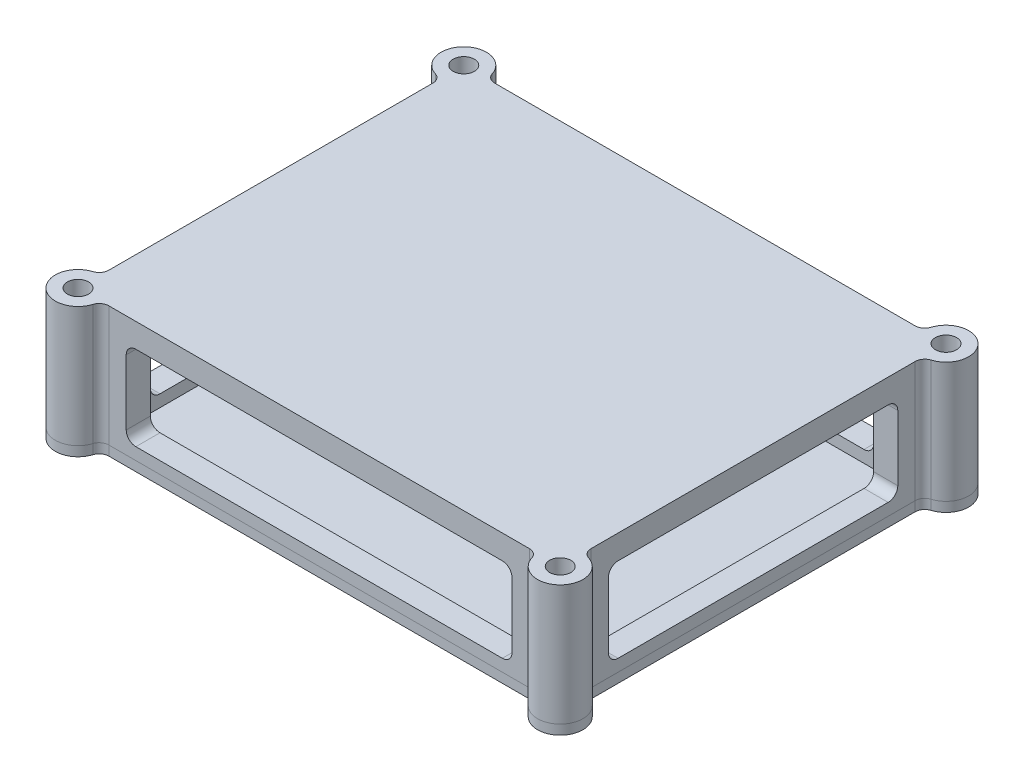
from build123d import *

# Parameters (mm, degrees)
SKETCH1_W           = 127
SKETCH1_H           = 101.6
BOSS_EXTRUDE1_DEPTH = 31.75
SKETCH3_W           = 114.3
SKETCH3_H           = 88.9
CUT_EXTRUDE1_DEPTH  = 27.94
SKETCH4_W           = 101.6
SKETCH4_H           = 22.225
CUT_EXTRUDE2_DEPTH  = 166.709452054
SKETCH5_W           = 76.2
SKETCH5_H           = 22.225
CUT_EXTRUDE3_DEPTH  = 166.709452054
SKETCH6_R           = 5.969
SKETCH6_R_2         = 2.794
BOSS_EXTRUDE2_DEPTH = 31.75
CUT_EXTRUDE4_DEPTH  = 174.953750238
FILLET1_R           = 2.54
SKETCH7_R           = 2.794
SKETCH7_W           = 76.2
SKETCH7_H           = 50.8
BOSS_EXTRUDE3_DEPTH = 2.54
FILLET2_R           = 2.54


with BuildPart() as part:
    # Sketch1 → Boss-Extrude1 (new body)
    with BuildSketch(Plane(origin=(0, 0, 0), x_dir=(1, 0, 0), z_dir=(0, 1, 0))):
        with Locations((63.5, 50.8)):
            Rectangle(SKETCH1_W, SKETCH1_H)
    extrude(amount=BOSS_EXTRUDE1_DEPTH)

    # Sketch3 → Cut-Extrude1 (cut)
    with BuildSketch(Plane.XZ):
        with Locations((63.5, -50.8)):
            Rectangle(SKETCH3_W, SKETCH3_H)
    extrude(amount=-CUT_EXTRUDE1_DEPTH, mode=Mode.SUBTRACT)

    # Sketch4 → Cut-Extrude2 (cut, through all)
    with BuildSketch(Plane(origin=(0, 0, -101.6), x_dir=(-1, 0, 0), z_dir=(0, 0, -1))):
        with Locations((-63.5, 14.2875)):
            Rectangle(SKETCH4_W, SKETCH4_H)
    extrude(amount=-CUT_EXTRUDE2_DEPTH, mode=Mode.SUBTRACT)

    # Sketch5 → Cut-Extrude3 (cut, through all)
    with BuildSketch(Plane(origin=(127, 0, 0), x_dir=(0, 0, -1), z_dir=(1, 0, 0))):
        with Locations((50.8, 14.2875)):
            Rectangle(SKETCH5_W, SKETCH5_H)
    extrude(amount=-CUT_EXTRUDE3_DEPTH, mode=Mode.SUBTRACT)

    # Sketch6 → Boss-Extrude2 (add, through all)
    # profile 1 of 6: a face of its own
    with BuildSketch(Plane(origin=(0, 0, 0), x_dir=(-1, 0, 0), z_dir=(0, -1, 0))):
        with BuildLine():
            ThreePointArc((0, 2.794), (1.975656347, 1.975656347), (2.794, 0))
            ThreePointArc((2.794, 0), (0, -2.794), (-2.794, 0))
            Line((-2.794, 0), (-5.969, 0))
            ThreePointArc((-5.969, 0), (0, -5.969), (5.969, 0))
            ThreePointArc((5.969, 0), (4.220720377, 4.220720377), (0, 5.969))
            Line((0, 5.969), (0, 2.794))
        make_face()
    # profile 2 of 6: a face of its own
    with BuildSketch(Plane(origin=(0, 0, 0), x_dir=(-1, 0, 0), z_dir=(0, -1, 0))):
        with BuildLine():
            ThreePointArc((-2.794, 0), (-1.975656347, 1.975656347), (0, 2.794))
            Line((0, 2.794), (0, 5.969))
            ThreePointArc((0, 5.969), (-4.220720377, 4.220720377), (-5.969, 0))
            Line((-5.969, 0), (-2.794, 0))
        make_face()
    # profile 3 of 6: a face of its own
    with BuildSketch(Plane(origin=(0, 0, 0), x_dir=(-1, 0, 0), z_dir=(0, -1, 0))):
        with Locations((0, 101.6)):
            Circle(SKETCH6_R)
        with Locations((0, 101.6)):
            Circle(SKETCH6_R_2, mode=Mode.SUBTRACT)
    # profile 4 of 6: a face of its own
    with BuildSketch(Plane(origin=(0, 0, 0), x_dir=(-1, 0, 0), z_dir=(0, -1, 0))):
        with Locations((-127, 101.6)):
            Circle(SKETCH6_R)
        with Locations((-127, 101.6)):
            Circle(SKETCH6_R_2, mode=Mode.SUBTRACT)
    # profile 5 of 6: a face of its own
    with BuildSketch(Plane(origin=(0, 0, 0), x_dir=(-1, 0, 0), z_dir=(0, -1, 0))):
        with BuildLine():
            ThreePointArc((-127, 5.969), (-131.220720377, -4.220720377), (-121.031, 0))
            Line((-121.031, 0), (-124.206, 0))
            ThreePointArc((-124.206, 0), (-128.975656347, -1.975656347), (-127, 2.794))
            Line((-127, 2.794), (-127, 5.969))
        make_face()
    # profile 6 of 6: a face of its own
    with BuildSketch(Plane(origin=(0, 0, 0), x_dir=(-1, 0, 0), z_dir=(0, -1, 0))):
        with BuildLine():
            Line((-124.206, 0), (-121.031, 0))
            ThreePointArc((-121.031, 0), (-122.779279623, 4.220720377), (-127, 5.969))
            Line((-127, 5.969), (-127, 2.794))
            ThreePointArc((-127, 2.794), (-125.024343653, 1.975656347), (-124.206, 0))
        make_face()
    extrude(amount=-BOSS_EXTRUDE2_DEPTH)

    # Sketch6<4> → Cut-Extrude4 (cut, through all)
    with BuildSketch(Plane(origin=(0, 0, 0), x_dir=(-1, 0, 0), z_dir=(0, -1, 0))):
        with BuildLine():
            Line((0, 101.6), (0, 98.806))
            ThreePointArc((0, 98.806), (1.975656347, 99.624343653), (2.794, 101.6))
            ThreePointArc((2.794, 101.6), (0, 104.394), (-2.794, 101.6))
            Line((-2.794, 101.6), (0, 101.6))
        make_face()
        with BuildLine():
            ThreePointArc((-2.794, 101.6), (-1.975656347, 99.624343653), (0, 98.806))
            Line((0, 98.806), (0, 101.6))
            Line((0, 101.6), (-2.794, 101.6))
        make_face()
        with BuildLine():
            Line((0, 101.6), (0, 98.806))
            ThreePointArc((0, 98.806), (1.975656347, 99.624343653), (2.794, 101.6))
            ThreePointArc((2.794, 101.6), (0, 104.394), (-2.794, 101.6))
            Line((-2.794, 101.6), (0, 101.6))
        make_face()
        with BuildLine():
            ThreePointArc((-2.794, 101.6), (-1.975656347, 99.624343653), (0, 98.806))
            Line((0, 98.806), (0, 101.6))
            Line((0, 101.6), (-2.794, 101.6))
        make_face()
        with BuildLine():
            Line((-127, 101.6), (-124.206, 101.6))
            ThreePointArc((-124.206, 101.6), (-128.975656347, 103.575656347), (-127, 98.806))
            Line((-127, 98.806), (-127, 101.6))
        make_face()
        with BuildLine():
            ThreePointArc((-127, 98.806), (-125.024343653, 99.624343653), (-124.206, 101.6))
            Line((-124.206, 101.6), (-127, 101.6))
            Line((-127, 101.6), (-127, 98.806))
        make_face()
        with BuildLine():
            Line((-127, 101.6), (-124.206, 101.6))
            ThreePointArc((-124.206, 101.6), (-128.975656347, 103.575656347), (-127, 98.806))
            Line((-127, 98.806), (-127, 101.6))
        make_face()
        with BuildLine():
            ThreePointArc((-127, 98.806), (-125.024343653, 99.624343653), (-124.206, 101.6))
            Line((-124.206, 101.6), (-127, 101.6))
            Line((-127, 101.6), (-127, 98.806))
        make_face()
        with BuildLine():
            Line((-127, 0), (-124.206, 0))
            ThreePointArc((-124.206, 0), (-125.024343653, 1.975656347), (-127, 2.794))
            Line((-127, 2.794), (-127, 0))
        make_face()
        with BuildLine():
            ThreePointArc((-127, 2.794), (-128.975656347, -1.975656347), (-124.206, 0))
            Line((-124.206, 0), (-127, 0))
            Line((-127, 0), (-127, 2.794))
        make_face()
        with BuildLine():
            Line((-127, 0), (-124.206, 0))
            ThreePointArc((-124.206, 0), (-125.024343653, 1.975656347), (-127, 2.794))
            Line((-127, 2.794), (-127, 0))
        make_face()
        with BuildLine():
            ThreePointArc((-127, 2.794), (-128.975656347, -1.975656347), (-124.206, 0))
            Line((-124.206, 0), (-127, 0))
            Line((-127, 0), (-127, 2.794))
        make_face()
        with BuildLine():
            ThreePointArc((-2.794, 0), (0, -2.794), (2.794, 0))
            ThreePointArc((2.794, 0), (1.975656347, 1.975656347), (0, 2.794))
            Line((0, 2.794), (0, 0))
            Line((0, 0), (-2.794, 0))
        make_face()
        with BuildLine():
            Line((0, 0), (0, 2.794))
            ThreePointArc((0, 2.794), (-1.975656347, 1.975656347), (-2.794, 0))
            Line((-2.794, 0), (0, 0))
        make_face()
        with BuildLine():
            ThreePointArc((-2.794, 0), (0, -2.794), (2.794, 0))
            ThreePointArc((2.794, 0), (1.975656347, 1.975656347), (0, 2.794))
            Line((0, 2.794), (0, 0))
            Line((0, 0), (-2.794, 0))
        make_face()
        with BuildLine():
            Line((0, 0), (0, 2.794))
            ThreePointArc((0, 2.794), (-1.975656347, 1.975656347), (-2.794, 0))
            Line((-2.794, 0), (0, 0))
        make_face()
    extrude(amount=-CUT_EXTRUDE4_DEPTH, mode=Mode.SUBTRACT)

    # Fillet1
    fillet1_edges = [part.edges().sort_by_distance(p)[0] for p in [
        (0, 15.875, -95.631),
        (5.969, 15.875, -101.6),
        (121.031, 15.875, -101.6),
        (127, 15.875, -95.631),
        (127, 15.875, -5.969),
        (121.031, 15.875, 0),
        (114.3, 3.175, -3.175),
        (114.3, 3.175, -98.425),
        (114.3, 25.4, -3.175),
        (114.3, 25.4, -98.425),
        (12.7, 25.4, -3.175),
        (12.7, 25.4, -98.425),
        (12.7, 3.175, -3.175),
        (12.7, 3.175, -98.425),
        (3.175, 3.175, -88.9),
        (123.825, 3.175, -88.9),
        (3.175, 3.175, -12.7),
        (123.825, 3.175, -12.7),
        (3.175, 25.4, -12.7),
        (123.825, 25.4, -12.7),
        (3.175, 25.4, -88.9),
        (123.825, 25.4, -88.9),
        (5.969, 15.875, 0),
        (0, 15.875, -5.969),
    ]]
    fillet(fillet1_edges, radius=FILLET1_R)


with BuildPart() as body_2:
    # Sketch7 → Boss-Extrude3 (new body)
    with BuildSketch(Plane.XZ):
        with BuildLine():
            Line((127, -93.478948282), (127, -8.121051718))
            ThreePointArc((127, -8.121051718), (127.493362423, -6.616766297), (128.781791045, -5.696857175))
            ThreePointArc((128.781791045, -5.696857175), (131.220720377, 4.220720377), (121.303142825, 1.781791045))
            ThreePointArc((121.303142825, 1.781791045), (120.383233703, 0.493362423), (118.878948282, 0))
            Line((118.878948282, 0), (8.121051718, 0))
            ThreePointArc((8.121051718, 0), (6.616766297, 0.493362423), (5.696857175, 1.781791045))
            ThreePointArc((5.696857175, 1.781791045), (-4.220720377, 4.220720377), (-1.781791045, -5.696857175))
            ThreePointArc((-1.781791045, -5.696857175), (-0.493362423, -6.616766297), (0, -8.121051718))
            Line((0, -8.121051718), (0, -93.478948282))
            ThreePointArc((0, -93.478948282), (-0.493362423, -94.983233703), (-1.781791045, -95.903142825))
            ThreePointArc((-1.781791045, -95.903142825), (-4.220720377, -105.820720377), (5.696857175, -103.381791045))
            ThreePointArc((5.696857175, -103.381791045), (6.616766297, -102.093362423), (8.121051718, -101.6))
            Line((8.121051718, -101.6), (118.878948282, -101.6))
            ThreePointArc((118.878948282, -101.6), (120.383233703, -102.093362423), (121.303142825, -103.381791045))
            ThreePointArc((121.303142825, -103.381791045), (131.220720377, -105.820720377), (128.781791045, -95.903142825))
            ThreePointArc((128.781791045, -95.903142825), (127.493362423, -94.983233703), (127, -93.478948282))
        make_face()
        with Locations(Location((127, 0, 0), (0, 0, 270))):
            Circle(SKETCH7_R, mode=Mode.SUBTRACT)
        with Locations(Location((127, -101.6, 0), (0, 0, 270))):
            Circle(SKETCH7_R, mode=Mode.SUBTRACT)
        with Locations(Location((0, 0, 0), (0, 0, 270))):
            Circle(SKETCH7_R, mode=Mode.SUBTRACT)
        with Locations(Location((0, -101.6, 0), (0, 0, 270))):
            Circle(SKETCH7_R, mode=Mode.SUBTRACT)
        with Locations((63.5, -50.8)):
            Rectangle(SKETCH7_W, SKETCH7_H, mode=Mode.SUBTRACT)
    extrude(amount=BOSS_EXTRUDE3_DEPTH)

    # Fillet2
    fillet2_edges = [body_2.edges().sort_by_distance(p)[0] for p in [
        (101.6, -1.27, -25.4),
        (25.4, -1.27, -25.4),
        (25.4, -1.27, -76.2),
        (101.6, -1.27, -76.2),
    ]]
    fillet(fillet2_edges, radius=FILLET2_R)


solid = Compound([part.part, body_2.part])
